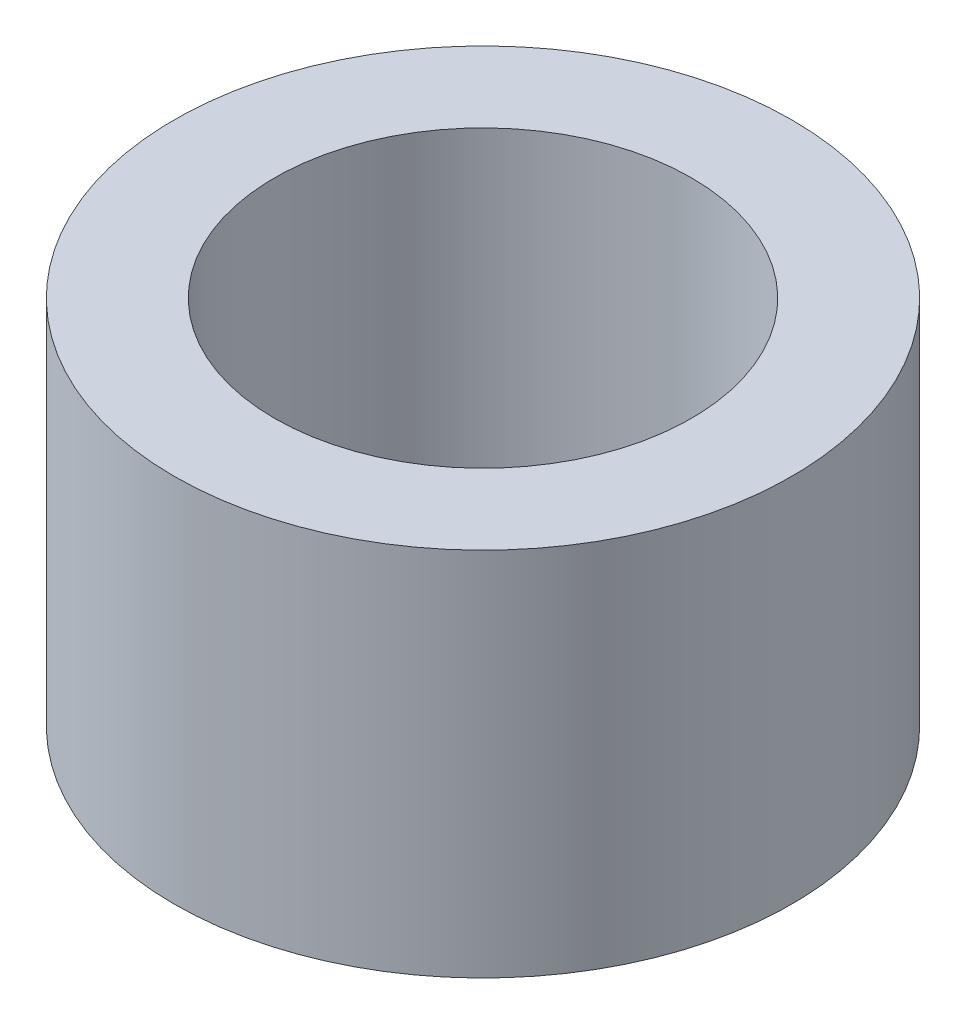
from build123d import *

# Parameters (mm, degrees)
SKETCH1_R           = 5.08
SKETCH1_R_2         = 3.429
BOSS_EXTRUDE1_DEPTH = 6.096


with BuildPart() as part:
    # Sketch1 → Boss-Extrude1 (new body)
    with BuildSketch(Plane(origin=(0, 0, 0), x_dir=(1, 0, 0), z_dir=(0, 1, 0))):
        with Locations(Location((0, 0, 0), (0, 0, 90))):
            Circle(SKETCH1_R)
        with Locations(Location((0, 0, 0), (0, 0, 90))):
            Circle(SKETCH1_R_2, mode=Mode.SUBTRACT)
    extrude(amount=BOSS_EXTRUDE1_DEPTH)


solid = part.part
